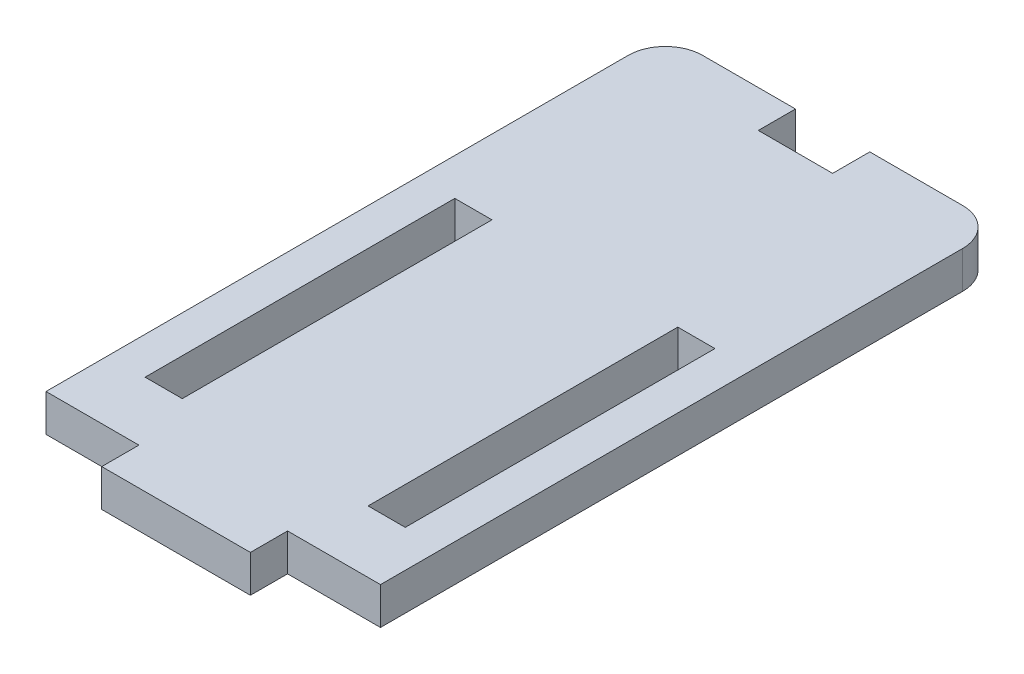
from build123d import *

# Parameters (mm, degrees)
SKETCH1_W               = 27
SKETCH1_H               = 50
BOSS_EXTRUDE1_DEPTH     = 1.5
SKETCH2_W               = 12
SKETCH2_H               = 3
BOSS_EXTRUDE2_DEPTH     = 1.5
CUT_EXTRUDE1_DEPTH      = 32.120732639
CUT_EXTRUDE1_DEPTH_BACK = 32.120732639
SKETCH4_W               = 3
SKETCH4_H               = 25
FILLET1_R               = 3
CUT_EXTRUDE2_DEPTH      = 32.120732639
CUT_EXTRUDE2_DEPTH_BACK = 32.120732639
SKETCH5_W               = 6
SKETCH5_H               = 3


with BuildPart() as part:
    # Sketch1 → Boss-Extrude1 (new, symmetric)
    with BuildSketch(Plane(origin=(0, 0, 0), x_dir=(1, 0, 0), z_dir=(0, 1, 0))):
        Rectangle(SKETCH1_W, SKETCH1_H)
    extrude(amount=BOSS_EXTRUDE1_DEPTH, both=True)

    # Sketch2 → Boss-Extrude2 (add, symmetric)
    with BuildSketch(Plane(origin=(0, 0, 0), x_dir=(1, 0, 0), z_dir=(0, 1, 0))):
        with Locations((0, -26.5)):
            Rectangle(SKETCH2_W, SKETCH2_H)
    extrude(amount=BOSS_EXTRUDE2_DEPTH, both=True)

    # Sketch4 → Cut-Extrude1 (cut, two sides: drawn at the far end of the back side and taken through both)
    with BuildSketch(Plane(origin=(0, 0, 0), x_dir=(1, 0, 0), z_dir=(0, 1, 0)).offset(-CUT_EXTRUDE1_DEPTH_BACK)):
        with Locations((-9, -7.5)):
            Rectangle(SKETCH4_W, SKETCH4_H)
        with Locations((9, -7.5)):
            Rectangle(SKETCH4_W, SKETCH4_H)
    extrude(amount=CUT_EXTRUDE1_DEPTH + CUT_EXTRUDE1_DEPTH_BACK, mode=Mode.SUBTRACT)

    # Fillet1
    fillet1_edges = [part.edges().sort_by_distance(p)[0] for p in [
        (-13.5, 0, -25),
        (13.5, 0, -25),
    ]]
    fillet(fillet1_edges, radius=FILLET1_R)

    # Sketch5 → Cut-Extrude2 (cut, two sides: drawn at the far end of the back side and taken through both)
    with BuildSketch(Plane(origin=(0, 0, 0), x_dir=(1, 0, 0), z_dir=(0, 1, 0)).offset(-CUT_EXTRUDE2_DEPTH_BACK)):
        with Locations((0, 23.5)):
            Rectangle(SKETCH5_W, SKETCH5_H)
    extrude(amount=CUT_EXTRUDE2_DEPTH + CUT_EXTRUDE2_DEPTH_BACK, mode=Mode.SUBTRACT)


solid = part.part
